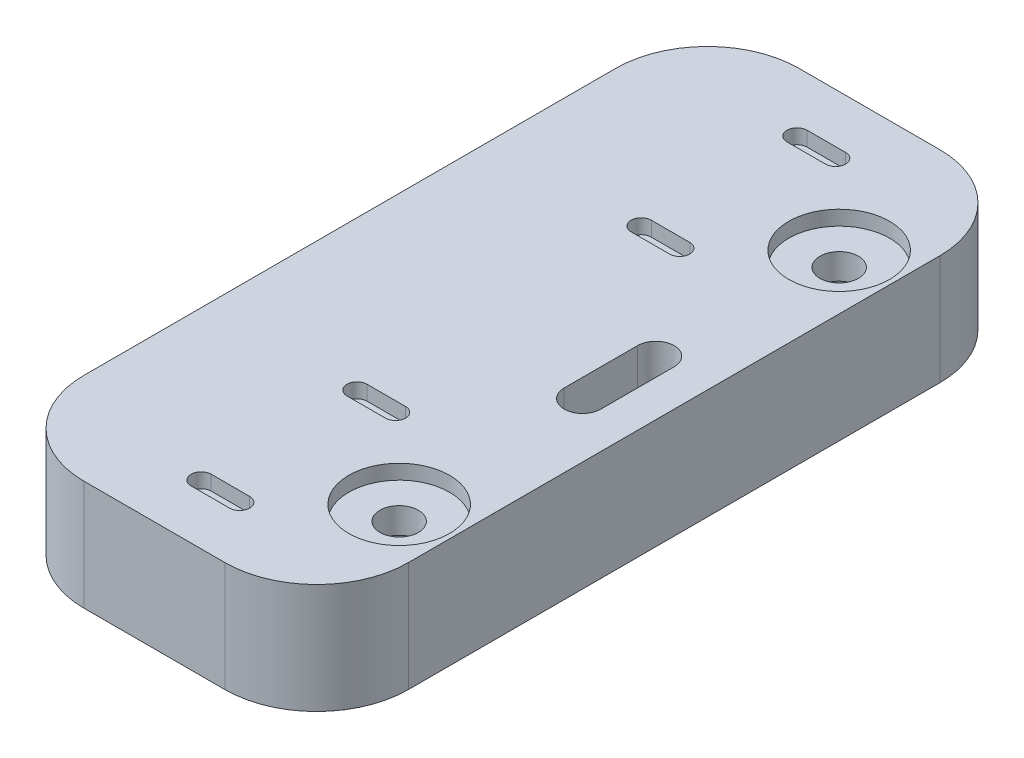
from build123d import *

# Parameters (mm, degrees)
SKETCH1_W           = 17.691665124
SKETCH1_H           = 39
SKETCH1_R           = 1.05
BOSS_EXTRUDE1_DEPTH = 6
SKETCH6_R           = 2.5
CUT_EXTRUDE1_DEPTH  = 3.8
FILLET1_R           = 5
FILLET2_R           = 5
SKETCH7_R           = 2.75
CUT_EXTRUDE2_DEPTH  = 0.8


with BuildPart() as part:
    # Sketch1 → Boss-Extrude1 (new body)
    with BuildSketch(Plane(origin=(0, 0, 0), x_dir=(1, 0, 0), z_dir=(0, 1, 0))):
        with Locations((23.537497687, 0)):
            Rectangle(SKETCH1_W, SKETCH1_H)
        with Locations(Location((29.383330249, -12, 0), (0, 0, 270))):
            Circle(SKETCH1_R, mode=Mode.SUBTRACT)
        with BuildLine():
            ThreePointArc((30.383330249, -2), (29.383330249, -3), (28.383330249, -2))
            Line((28.383330249, -2), (28.383330249, 2))
            ThreePointArc((28.383330249, 2), (29.383330249, 3), (30.383330249, 2))
            Line((30.383330249, 2), (30.383330249, -2))
        make_face(mode=Mode.SUBTRACT)
        with Locations(Location((29.383330249, 12, 0), (0, 0, 270))):
            Circle(SKETCH1_R, mode=Mode.SUBTRACT)
    extrude(amount=BOSS_EXTRUDE1_DEPTH)

    # Sketch6 → Cut-Extrude1 (cut)
    with BuildSketch(Plane(origin=(0, 0, 0), x_dir=(-1, 0, 0), z_dir=(0, -1, 0))):
        with Locations((-29.383330249, -12)):
            Circle(SKETCH6_R)
        with Locations((-29.383330249, 12)):
            Circle(SKETCH6_R)
        Polygon((-30.633330249, -9.834936491), (-30.308330249, -10.397853003), (-17.317949192, -2.897853003), (-17.642949192, -2.334936491), align=None)
        Polygon((-30.633330249, 9.834936491), (-30.308330249, 10.397853003), (-17.317949192, 2.897853003), (-17.642949192, 2.334936491), align=None)
    extrude(amount=-CUT_EXTRUDE1_DEPTH, mode=Mode.SUBTRACT)

    # Fillet1
    fillet1_edges = [part.edges().sort_by_distance(p)[0] for p in [
        (32.383330249, 3, 19.5),
        (32.383330249, 3, -19.5),
    ]]
    fillet(fillet1_edges, radius=FILLET1_R)

    # Fillet2
    fillet2_edges = [part.edges().sort_by_distance(p)[0] for p in [
        (14.691665125, 3, 19.5),
        (14.691665125, 3, -19.5),
    ]]
    fillet(fillet2_edges, radius=FILLET2_R)

    # Sketch7 → Cut-Extrude2 (cut)
    with BuildSketch(Plane(origin=(0, 6, 0), x_dir=(1, 0, 0), z_dir=(0, 1, 0))):
        with Locations(Location((29.383330249, 12, 0), (0, 0, 270))):
            Circle(SKETCH7_R)
        with Locations(Location((29.383330249, -12, 0), (0, 0, 90))):
            Circle(SKETCH7_R)
        with BuildLine():
            Line((22.833330249, 16.8), (24.933330249, 16.8))
            ThreePointArc((24.933330249, 16.8), (25.483330249, 16.25), (24.933330249, 15.7))
            Line((24.933330249, 15.7), (22.833330249, 15.7))
            ThreePointArc((22.833330249, 15.7), (22.283330249, 16.25), (22.833330249, 16.8))
        make_face()
        with BuildLine():
            Line((22.833330249, 7.2), (24.933330249, 7.2))
            ThreePointArc((24.933330249, 7.2), (25.483330249, 7.75), (24.933330249, 8.3))
            Line((24.933330249, 8.3), (22.833330249, 8.3))
            ThreePointArc((22.833330249, 8.3), (22.283330249, 7.75), (22.833330249, 7.2))
        make_face()
        with BuildLine():
            Line((22.833330249, -7.2), (24.933330249, -7.2))
            ThreePointArc((24.933330249, -7.2), (25.483330249, -7.75), (24.933330249, -8.3))
            Line((24.933330249, -8.3), (22.833330249, -8.3))
            ThreePointArc((22.833330249, -8.3), (22.283330249, -7.75), (22.833330249, -7.2))
        make_face()
        with BuildLine():
            Line((22.833330249, -16.8), (24.933330249, -16.8))
            ThreePointArc((24.933330249, -16.8), (25.483330249, -16.25), (24.933330249, -15.7))
            Line((24.933330249, -15.7), (22.833330249, -15.7))
            ThreePointArc((22.833330249, -15.7), (22.283330249, -16.25), (22.833330249, -16.8))
        make_face()
    extrude(amount=-CUT_EXTRUDE2_DEPTH, mode=Mode.SUBTRACT)


solid = part.part
